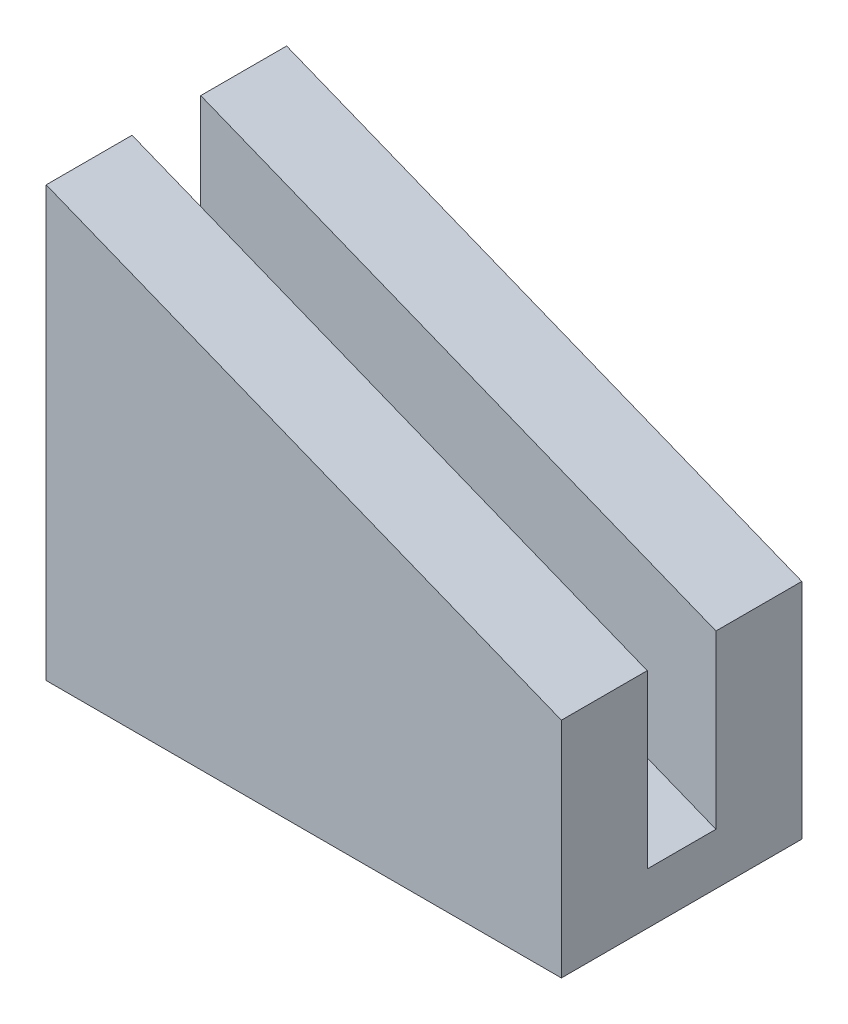
from build123d import *

# Parameters (mm, degrees)
SKETCH1_W               = 76.2
SKETCH1_H               = 35.56
BOSS_EXTRUDE1_DEPTH     = 63.5
SKETCH2_W               = 76.2
SKETCH2_H               = 10.16
CUT_EXTRUDE1_DEPTH      = 25.4
CUT_EXTRUDE2_DEPTH      = 10.16
CUT_EXTRUDE3_DEPTH      = 78.501223216
CUT_EXTRUDE3_DEPTH_BACK = 78.501223216


with BuildPart() as part:
    # Sketch1 → Boss-Extrude1 (new body)
    with BuildSketch(Plane(origin=(0, 0, 0), x_dir=(1, 0, 0), z_dir=(0, 1, 0))):
        Rectangle(SKETCH1_W, SKETCH1_H)
    extrude(amount=BOSS_EXTRUDE1_DEPTH)

    # Sketch2 → Cut-Extrude1 (cut)
    with BuildSketch(Plane(origin=(0, 63.5, 0), x_dir=(1, 0, 0), z_dir=(0, 1, 0))):
        Rectangle(SKETCH2_W, SKETCH2_H)
    extrude(amount=-CUT_EXTRUDE1_DEPTH, mode=Mode.SUBTRACT)

    # Sketch3 → Cut-Extrude2 (cut)
    with BuildSketch(Plane.XY.offset(-5.08)):
        Polygon((38.1, 7.62), (38.1, 38.1), (-38.1, 38.1), align=None)
    extrude(amount=CUT_EXTRUDE2_DEPTH, mode=Mode.SUBTRACT)

    # Sketch4 → Cut-Extrude3 (cut, two sides: drawn at the far end of the back side and taken through both)
    with BuildSketch(Plane(origin=(0, 0, 5.08), x_dir=(-1, 0, 0), z_dir=(0, 0, -1)).offset(-CUT_EXTRUDE3_DEPTH_BACK)):
        Polygon((38.1, 63.5), (-38.1, 33.02), (-38.1, 63.5), align=None)
    extrude(amount=CUT_EXTRUDE3_DEPTH + CUT_EXTRUDE3_DEPTH_BACK, mode=Mode.SUBTRACT)


solid = part.part
